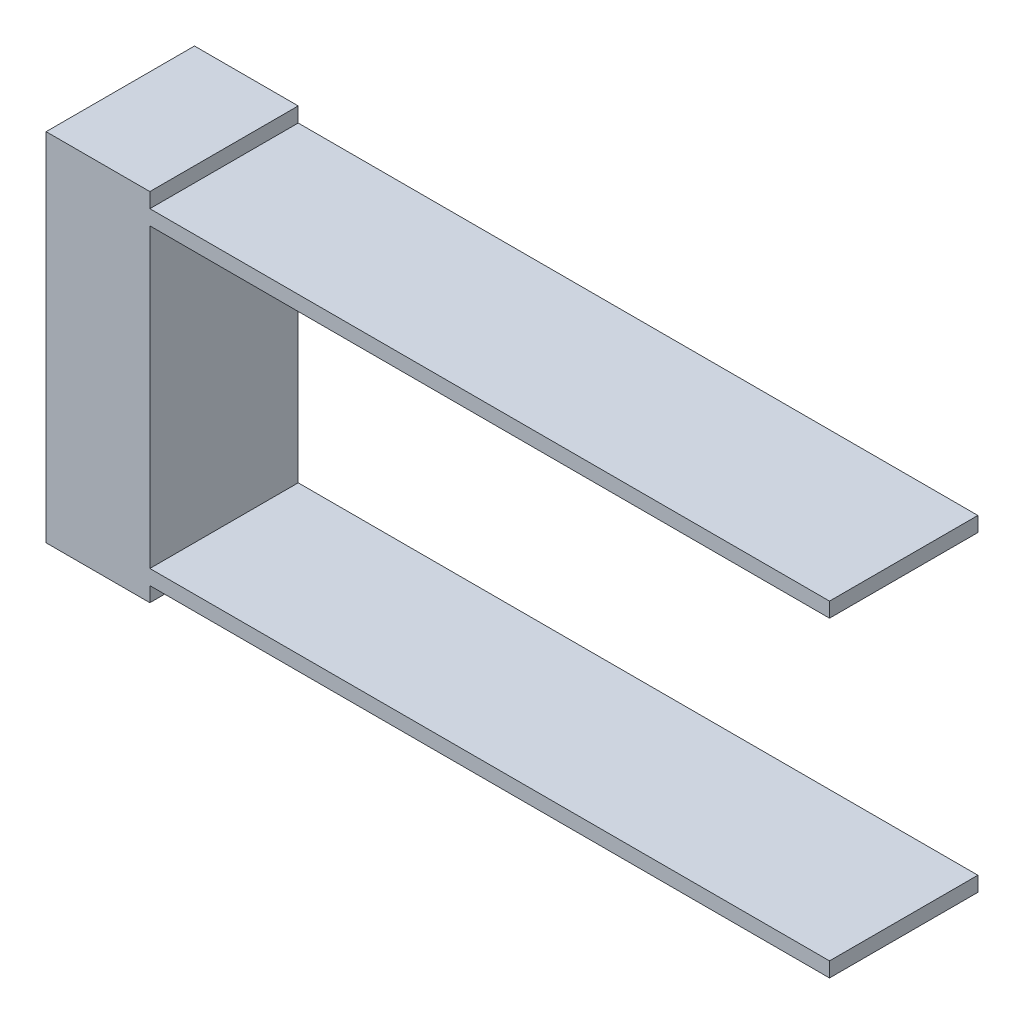
from build123d import *

# Parameters (mm, degrees)
BOSS_EXTRUDE1_DEPTH = 25


with BuildPart() as part:
    # Sketch1 → Boss-Extrude1 (new body)
    with BuildSketch(Plane.XY):
        Polygon((-48.520030234, 25), (-48.520030234, -25), (66, -25), (66, -27.5), (-48.520030234, -27.5), (-48.520030234, -30), (-66, -30), (-66, 30), (-48.520030234, 30), (-48.520030234, 27.5), (66, 27.5), (66, 25), align=None)
    extrude(amount=BOSS_EXTRUDE1_DEPTH)


solid = part.part
